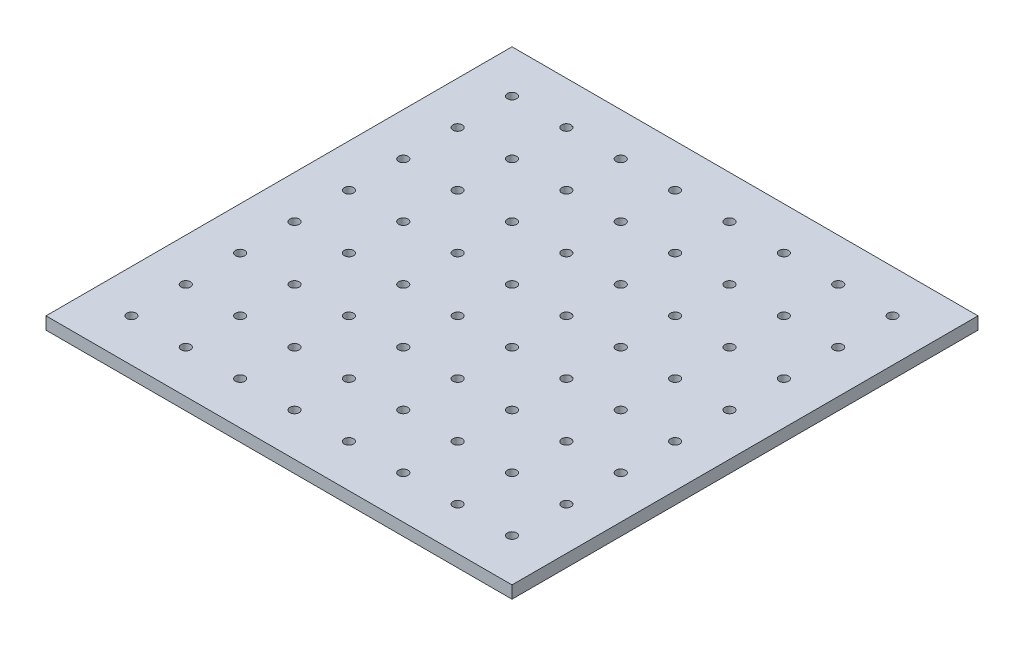
from build123d import *

# Parameters (mm, degrees)
SKETCH1_W           = 150
SKETCH1_H           = 150
SKETCH1_R           = 1.5
BOSS_EXTRUDE1_DEPTH = 4


with BuildPart() as part:
    # Sketch1 → Boss-Extrude1 (new body)
    with BuildSketch(Plane(origin=(0, 0, 0), x_dir=(1, 0, 0), z_dir=(0, 1, 0))):
        Rectangle(SKETCH1_W, SKETCH1_H)
        with Locations(Location((-61.25, -61.25, 0), (0, 0, 270))):
            Circle(SKETCH1_R, mode=Mode.SUBTRACT)
        with Locations(Location((-43.75, -61.25, 0), (0, 0, 270))):
            Circle(SKETCH1_R, mode=Mode.SUBTRACT)
        with Locations(Location((-26.25, -61.25, 0), (0, 0, 270))):
            Circle(SKETCH1_R, mode=Mode.SUBTRACT)
        with Locations(Location((-8.75, -61.25, 0), (0, 0, 270))):
            Circle(SKETCH1_R, mode=Mode.SUBTRACT)
        with Locations(Location((8.75, -61.25, 0), (0, 0, 270))):
            Circle(SKETCH1_R, mode=Mode.SUBTRACT)
        with Locations(Location((26.25, -61.25, 0), (0, 0, 270))):
            Circle(SKETCH1_R, mode=Mode.SUBTRACT)
        with Locations(Location((43.75, -61.25, 0), (0, 0, 270))):
            Circle(SKETCH1_R, mode=Mode.SUBTRACT)
        with Locations(Location((61.25, -61.25, 0), (0, 0, 270))):
            Circle(SKETCH1_R, mode=Mode.SUBTRACT)
        with Locations(Location((-43.75, -43.75, 0), (0, 0, 270))):
            Circle(SKETCH1_R, mode=Mode.SUBTRACT)
        with Locations(Location((-26.25, -43.75, 0), (0, 0, 270))):
            Circle(SKETCH1_R, mode=Mode.SUBTRACT)
        with Locations(Location((-8.75, -43.75, 0), (0, 0, 270))):
            Circle(SKETCH1_R, mode=Mode.SUBTRACT)
        with Locations(Location((8.75, -43.75, 0), (0, 0, 270))):
            Circle(SKETCH1_R, mode=Mode.SUBTRACT)
        with Locations(Location((26.25, -43.75, 0), (0, 0, 270))):
            Circle(SKETCH1_R, mode=Mode.SUBTRACT)
        with Locations(Location((43.75, -43.75, 0), (0, 0, 270))):
            Circle(SKETCH1_R, mode=Mode.SUBTRACT)
        with Locations(Location((61.25, -43.75, 0), (0, 0, 270))):
            Circle(SKETCH1_R, mode=Mode.SUBTRACT)
        with Locations(Location((-43.75, -26.25, 0), (0, 0, 270))):
            Circle(SKETCH1_R, mode=Mode.SUBTRACT)
        with Locations(Location((-26.25, -26.25, 0), (0, 0, 270))):
            Circle(SKETCH1_R, mode=Mode.SUBTRACT)
        with Locations(Location((-8.75, -26.25, 0), (0, 0, 270))):
            Circle(SKETCH1_R, mode=Mode.SUBTRACT)
        with Locations(Location((8.75, -26.25, 0), (0, 0, 270))):
            Circle(SKETCH1_R, mode=Mode.SUBTRACT)
        with Locations(Location((26.25, -26.25, 0), (0, 0, 270))):
            Circle(SKETCH1_R, mode=Mode.SUBTRACT)
        with Locations(Location((43.75, -26.25, 0), (0, 0, 270))):
            Circle(SKETCH1_R, mode=Mode.SUBTRACT)
        with Locations(Location((61.25, -26.25, 0), (0, 0, 270))):
            Circle(SKETCH1_R, mode=Mode.SUBTRACT)
        with Locations(Location((-43.75, -8.75, 0), (0, 0, 270))):
            Circle(SKETCH1_R, mode=Mode.SUBTRACT)
        with Locations(Location((-26.25, -8.75, 0), (0, 0, 270))):
            Circle(SKETCH1_R, mode=Mode.SUBTRACT)
        with Locations(Location((-8.75, -8.75, 0), (0, 0, 270))):
            Circle(SKETCH1_R, mode=Mode.SUBTRACT)
        with Locations(Location((8.75, -8.75, 0), (0, 0, 270))):
            Circle(SKETCH1_R, mode=Mode.SUBTRACT)
        with Locations(Location((26.25, -8.75, 0), (0, 0, 270))):
            Circle(SKETCH1_R, mode=Mode.SUBTRACT)
        with Locations(Location((43.75, -8.75, 0), (0, 0, 270))):
            Circle(SKETCH1_R, mode=Mode.SUBTRACT)
        with Locations(Location((61.25, -8.75, 0), (0, 0, 270))):
            Circle(SKETCH1_R, mode=Mode.SUBTRACT)
        with Locations(Location((-43.75, 8.75, 0), (0, 0, 270))):
            Circle(SKETCH1_R, mode=Mode.SUBTRACT)
        with Locations(Location((-26.25, 8.75, 0), (0, 0, 270))):
            Circle(SKETCH1_R, mode=Mode.SUBTRACT)
        with Locations(Location((-8.75, 8.75, 0), (0, 0, 270))):
            Circle(SKETCH1_R, mode=Mode.SUBTRACT)
        with Locations(Location((8.75, 8.75, 0), (0, 0, 270))):
            Circle(SKETCH1_R, mode=Mode.SUBTRACT)
        with Locations(Location((26.25, 8.75, 0), (0, 0, 270))):
            Circle(SKETCH1_R, mode=Mode.SUBTRACT)
        with Locations(Location((43.75, 8.75, 0), (0, 0, 270))):
            Circle(SKETCH1_R, mode=Mode.SUBTRACT)
        with Locations(Location((61.25, 8.75, 0), (0, 0, 270))):
            Circle(SKETCH1_R, mode=Mode.SUBTRACT)
        with Locations(Location((-43.75, 26.25, 0), (0, 0, 270))):
            Circle(SKETCH1_R, mode=Mode.SUBTRACT)
        with Locations(Location((-26.25, 26.25, 0), (0, 0, 270))):
            Circle(SKETCH1_R, mode=Mode.SUBTRACT)
        with Locations(Location((-8.75, 26.25, 0), (0, 0, 270))):
            Circle(SKETCH1_R, mode=Mode.SUBTRACT)
        with Locations(Location((8.75, 26.25, 0), (0, 0, 270))):
            Circle(SKETCH1_R, mode=Mode.SUBTRACT)
        with Locations(Location((26.25, 26.25, 0), (0, 0, 270))):
            Circle(SKETCH1_R, mode=Mode.SUBTRACT)
        with Locations(Location((43.75, 26.25, 0), (0, 0, 270))):
            Circle(SKETCH1_R, mode=Mode.SUBTRACT)
        with Locations(Location((61.25, 26.25, 0), (0, 0, 270))):
            Circle(SKETCH1_R, mode=Mode.SUBTRACT)
        with Locations(Location((-43.75, 43.75, 0), (0, 0, 270))):
            Circle(SKETCH1_R, mode=Mode.SUBTRACT)
        with Locations(Location((-26.25, 43.75, 0), (0, 0, 270))):
            Circle(SKETCH1_R, mode=Mode.SUBTRACT)
        with Locations(Location((-8.75, 43.75, 0), (0, 0, 270))):
            Circle(SKETCH1_R, mode=Mode.SUBTRACT)
        with Locations(Location((8.75, 43.75, 0), (0, 0, 270))):
            Circle(SKETCH1_R, mode=Mode.SUBTRACT)
        with Locations(Location((26.25, 43.75, 0), (0, 0, 270))):
            Circle(SKETCH1_R, mode=Mode.SUBTRACT)
        with Locations(Location((43.75, 43.75, 0), (0, 0, 270))):
            Circle(SKETCH1_R, mode=Mode.SUBTRACT)
        with Locations(Location((61.25, 43.75, 0), (0, 0, 270))):
            Circle(SKETCH1_R, mode=Mode.SUBTRACT)
        with Locations(Location((-43.75, 61.25, 0), (0, 0, 270))):
            Circle(SKETCH1_R, mode=Mode.SUBTRACT)
        with Locations(Location((-26.25, 61.25, 0), (0, 0, 270))):
            Circle(SKETCH1_R, mode=Mode.SUBTRACT)
        with Locations(Location((-8.75, 61.25, 0), (0, 0, 270))):
            Circle(SKETCH1_R, mode=Mode.SUBTRACT)
        with Locations(Location((8.75, 61.25, 0), (0, 0, 270))):
            Circle(SKETCH1_R, mode=Mode.SUBTRACT)
        with Locations(Location((26.25, 61.25, 0), (0, 0, 270))):
            Circle(SKETCH1_R, mode=Mode.SUBTRACT)
        with Locations(Location((43.75, 61.25, 0), (0, 0, 270))):
            Circle(SKETCH1_R, mode=Mode.SUBTRACT)
        with Locations(Location((61.25, 61.25, 0), (0, 0, 270))):
            Circle(SKETCH1_R, mode=Mode.SUBTRACT)
        with Locations(Location((-61.25, -43.75, 0), (0, 0, 270))):
            Circle(SKETCH1_R, mode=Mode.SUBTRACT)
        with Locations(Location((-61.25, -26.25, 0), (0, 0, 270))):
            Circle(SKETCH1_R, mode=Mode.SUBTRACT)
        with Locations(Location((-61.25, -8.75, 0), (0, 0, 270))):
            Circle(SKETCH1_R, mode=Mode.SUBTRACT)
        with Locations(Location((-61.25, 8.75, 0), (0, 0, 270))):
            Circle(SKETCH1_R, mode=Mode.SUBTRACT)
        with Locations(Location((-61.25, 26.25, 0), (0, 0, 270))):
            Circle(SKETCH1_R, mode=Mode.SUBTRACT)
        with Locations(Location((-61.25, 43.75, 0), (0, 0, 270))):
            Circle(SKETCH1_R, mode=Mode.SUBTRACT)
        with Locations(Location((-61.25, 61.25, 0), (0, 0, 270))):
            Circle(SKETCH1_R, mode=Mode.SUBTRACT)
    extrude(amount=BOSS_EXTRUDE1_DEPTH)


solid = part.part
